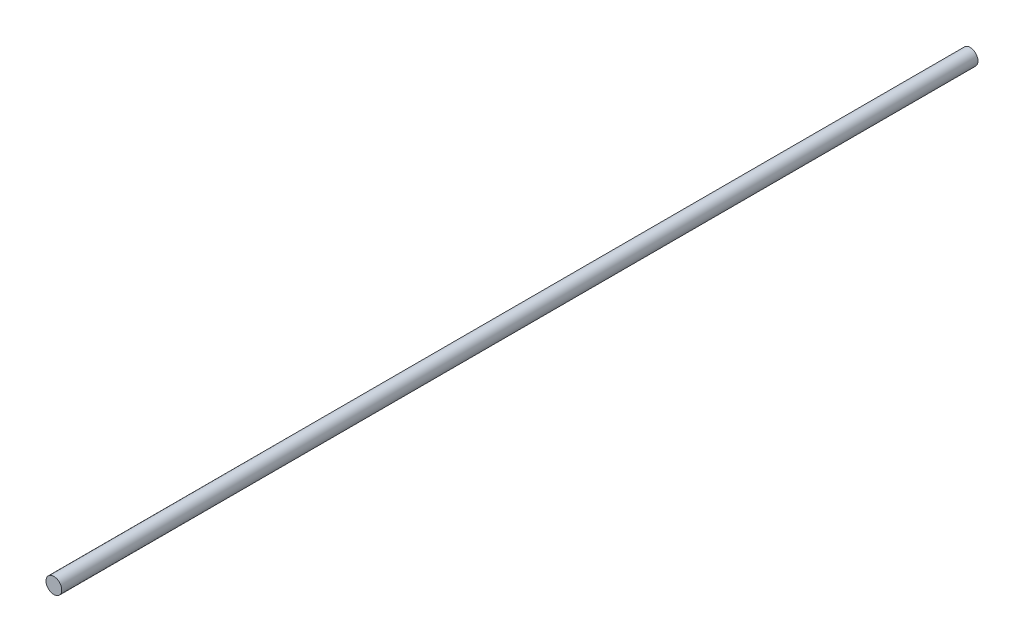
from build123d import *

# Parameters (mm, degrees)
SKETCH1_R           = 4
BOSS_EXTRUDE1_DEPTH = 465


with BuildPart() as part:
    # Sketch1 → Boss-Extrude1 (new body)
    with BuildSketch(Plane.XY):
        Circle(SKETCH1_R)
    extrude(amount=BOSS_EXTRUDE1_DEPTH)


solid = part.part
